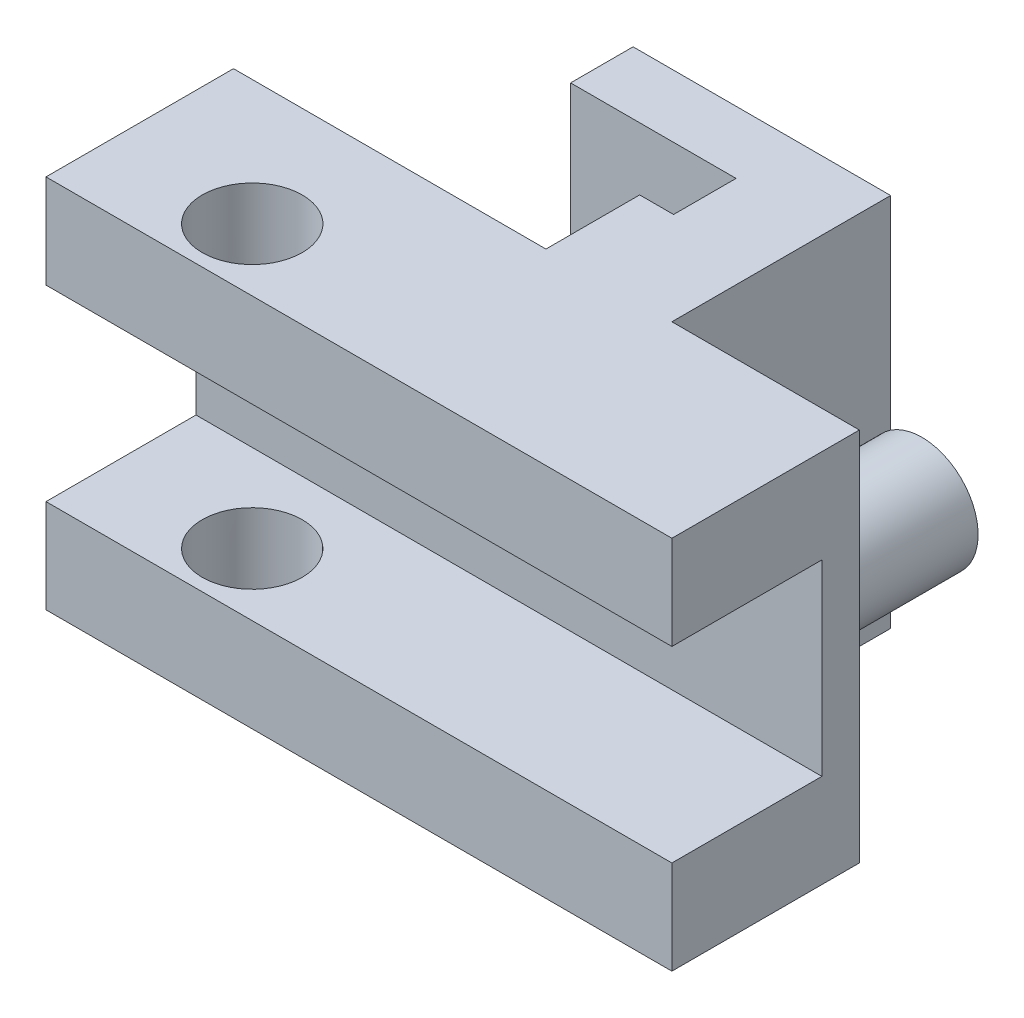
from build123d import *

# Parameters (mm, degrees)
SKETCH1_R           = 0.4
BOSS_EXTRUDE1_DEPTH = 3
SKETCH2_W           = 2.503917826
SKETCH2_H           = 0.75
SKETCH2_W_2         = 2.503917827
CUT_EXTRUDE1_DEPTH  = 1.2
SKETCH3_R           = 0.45
BOSS_EXTRUDE2_DEPTH = 1.25


with BuildPart() as part:
    # Sketch1 → Boss-Extrude1 (new body)
    with BuildSketch(Plane(origin=(0, 0, 0), x_dir=(1, 0, 0), z_dir=(0, 1, 0))):
        Polygon((-14.270322025, 5.01853909), (-16.770322025, 5.01853909), (-16.770322025, 4.01853909), (-16.770322025, 3.51853909), (-11.762486372, 3.51853909), (-11.762486372, 5.01853909), (-13.262486372, 5.01853909), (-13.262486372, 6.76853909), (-15.322928397, 6.76853909), (-15.322928397, 6.26853909), (-13.999008371, 6.26853909), (-13.999008371, 5.76853909), (-14.270322025, 5.76853909), align=None)
        with Locations(Location((-15.620322025, 4.01853909, 0), (0, 0, 270))):
            Circle(SKETCH1_R, mode=Mode.SUBTRACT)
    extrude(amount=BOSS_EXTRUDE1_DEPTH)

    # Sketch2 → Cut-Extrude1 (cut)
    with BuildSketch(Plane.XY.offset(-3.51853909)):
        with Locations((-15.518363112, 1.875)):
            Rectangle(SKETCH2_W, SKETCH2_H)
        with Locations((-13.014445286, 1.875)):
            Rectangle(SKETCH2_W_2, SKETCH2_H)
        with Locations((-15.518363112, 1.125)):
            Rectangle(SKETCH2_W, SKETCH2_H)
        with Locations((-13.014445286, 1.125)):
            Rectangle(SKETCH2_W_2, SKETCH2_H)
    extrude(amount=-CUT_EXTRUDE1_DEPTH, mode=Mode.SUBTRACT)

    # Sketch3 → Boss-Extrude2 (add)
    with BuildSketch(Plane(origin=(0, 0, -5.01853909), x_dir=(-1, 0, 0), z_dir=(0, 0, -1))):
        with Locations((12.512486372, 1.5)):
            Circle(SKETCH3_R)
    extrude(amount=BOSS_EXTRUDE2_DEPTH)


solid = part.part
